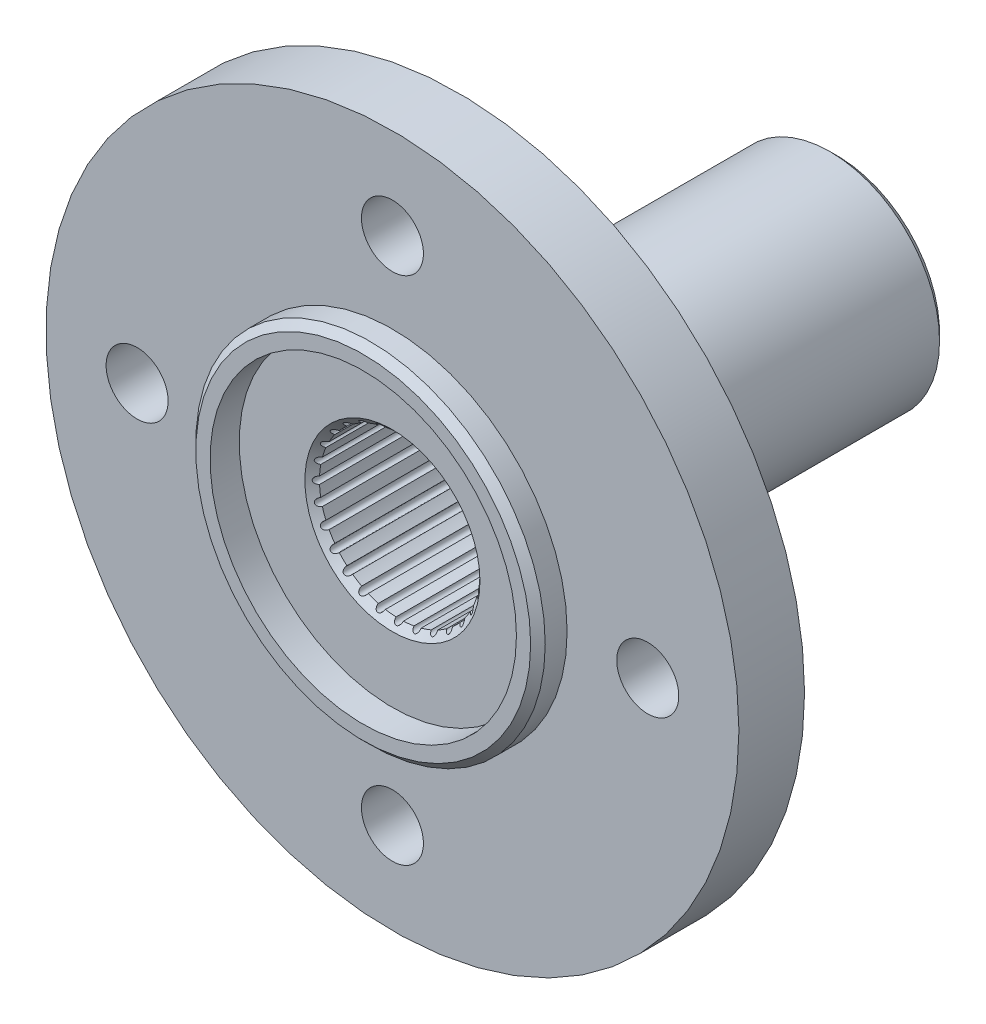
from build123d import *

# Parameters (mm, degrees)
SKETCH1_R           = 47.5
BOSS_EXTRUDE1_DEPTH = 9
SKETCH2_R           = 20
BOSS_EXTRUDE2_DEPTH = 22
SKETCH3_R           = 15
BOSS_EXTRUDE3_DEPTH = 30
SKETCH6_R           = 11
CUT_EXTRUDE2_DEPTH  = 25
CHAMFER2_SIZE       = 1
CUT_EXTRUDE5_REACH  = 92.739
SKETCH9_R           = 4.25
CHAMFER3_SIZE       = 1
SKETCH12_R          = 23.95
BOSS_EXTRUDE4_DEPTH = 4
SKETCH13_R          = 21
CUT_EXTRUDE6_DEPTH  = 4
CHAMFER4_SIZE       = 1
SKETCH8_R           = 0.5
CUT_EXTRUDE4_DEPTH  = 25
SKETCH14_R          = 11
CUT_EXTRUDE7_DEPTH  = 79.182478856
CHAMFER5_SIZE       = 1
SKETCH15_R          = 0.5
CUT_EXTRUDE8_DEPTH  = 94.474595479


with BuildPart() as part:
    # Sketch1 → Boss-Extrude1 (new body)
    with BuildSketch(Plane.XY):
        Circle(SKETCH1_R)
    extrude(amount=BOSS_EXTRUDE1_DEPTH)

    # Sketch2 → Boss-Extrude2 (add)
    with BuildSketch(Plane(origin=(0, 0, 0), x_dir=(-1, 0, 0), z_dir=(0, 0, -1))):
        Circle(SKETCH2_R)
    extrude(amount=BOSS_EXTRUDE2_DEPTH)

    # Sketch3 → Boss-Extrude3 (add)
    with BuildSketch(Plane(origin=(0, 0, -22), x_dir=(-1, 0, 0), z_dir=(0, 0, -1))):
        Circle(SKETCH3_R)
    extrude(amount=BOSS_EXTRUDE3_DEPTH)

    # Sketch6 → Cut-Extrude2 (cut)
    with BuildSketch(Plane(origin=(0, 0, -52), x_dir=(-1, 0, 0), z_dir=(0, 0, -1))):
        Circle(SKETCH6_R)
    extrude(amount=-CUT_EXTRUDE2_DEPTH, mode=Mode.SUBTRACT)

    # Chamfer2
    chamfer2_edges = [part.edges().sort_by_distance(p)[0] for p in [
        (11, 0, -52),
    ]]
    chamfer(chamfer2_edges, length=CHAMFER2_SIZE)

    # Sketch9 → Cut-Extrude5 (cut, up to next)
    with BuildSketch(Plane.XY.offset(9), mode=Mode.PRIVATE) as cut_extrude5_sk1:
        with Locations((0, 35)):
            Circle(SKETCH9_R)
    cut_extrude5_tool1 = extrude(cut_extrude5_sk1.sketch, amount=-CUT_EXTRUDE5_REACH, mode=Mode.PRIVATE) & part.part
    # Sketch9 → Cut-Extrude5 (cut, up to next)
    with BuildSketch(Plane.XY.offset(9), mode=Mode.PRIVATE) as cut_extrude5_sk2:
        with Locations((35, 0)):
            Circle(SKETCH9_R)
    cut_extrude5_tool2 = extrude(cut_extrude5_sk2.sketch, amount=-CUT_EXTRUDE5_REACH, mode=Mode.PRIVATE) & part.part
    # Sketch9 → Cut-Extrude5 (cut, up to next)
    with BuildSketch(Plane.XY.offset(9), mode=Mode.PRIVATE) as cut_extrude5_sk3:
        with Locations((0, -35)):
            Circle(SKETCH9_R)
    cut_extrude5_tool3 = extrude(cut_extrude5_sk3.sketch, amount=-CUT_EXTRUDE5_REACH, mode=Mode.PRIVATE) & part.part
    # Sketch9 → Cut-Extrude5 (cut, up to next)
    with BuildSketch(Plane.XY.offset(9), mode=Mode.PRIVATE) as cut_extrude5_sk4:
        with Locations((-35, 0)):
            Circle(SKETCH9_R)
    cut_extrude5_tool4 = extrude(cut_extrude5_sk4.sketch, amount=-CUT_EXTRUDE5_REACH, mode=Mode.PRIVATE) & part.part
    add(cut_extrude5_tool1.solids().sort_by_distance((0, 35, 9))[0], mode=Mode.SUBTRACT)
    add(cut_extrude5_tool2.solids().sort_by_distance((35, 0, 9))[0], mode=Mode.SUBTRACT)
    add(cut_extrude5_tool3.solids().sort_by_distance((0, -35, 9))[0], mode=Mode.SUBTRACT)
    add(cut_extrude5_tool4.solids().sort_by_distance((-35, 0, 9))[0], mode=Mode.SUBTRACT)

    # Chamfer3
    chamfer3_edges = [part.edges().sort_by_distance(p)[0] for p in [
        (15, 0, -52),
    ]]
    chamfer(chamfer3_edges, length=CHAMFER3_SIZE)

    # Sketch12 → Boss-Extrude4 (add)
    with BuildSketch(Plane.XY.offset(9)):
        Circle(SKETCH12_R)
    extrude(amount=BOSS_EXTRUDE4_DEPTH)

    # Sketch13 → Cut-Extrude6 (cut)
    with BuildSketch(Plane.XY.offset(13)):
        Circle(SKETCH13_R)
    extrude(amount=-CUT_EXTRUDE6_DEPTH, mode=Mode.SUBTRACT)

    # Chamfer4
    chamfer4_edges = [part.edges().sort_by_distance(p)[0] for p in [
        (-23.95, 0, 13),
    ]]
    chamfer(chamfer4_edges, length=CHAMFER4_SIZE)

    # Sketch8 → Cut-Extrude4 (cut)
    with BuildSketch(Plane(origin=(0, 0, -52), x_dir=(-1, 0, 0), z_dir=(0, 0, -1))):
        with Locations((0, 11)):
            Circle(SKETCH8_R)
        with Locations((2.447730274, 10.724207034)):
            Circle(SKETCH8_R)
        with Locations((4.77272113, 9.910657547)):
            Circle(SKETCH8_R)
        with Locations((6.85838782, 8.600146307)):
            Circle(SKETCH8_R)
        with Locations((8.600146307, 6.85838782)):
            Circle(SKETCH8_R)
        with Locations((9.910657547, 4.77272113)):
            Circle(SKETCH8_R)
        with Locations((10.724207034, 2.447730274)):
            Circle(SKETCH8_R)
        with Locations((11, 0)):
            Circle(SKETCH8_R)
        with Locations((10.724207034, -2.447730274)):
            Circle(SKETCH8_R)
        with Locations((9.910657547, -4.77272113)):
            Circle(SKETCH8_R)
        with Locations((8.600146307, -6.85838782)):
            Circle(SKETCH8_R)
        with Locations((6.85838782, -8.600146307)):
            Circle(SKETCH8_R)
        with Locations((4.77272113, -9.910657547)):
            Circle(SKETCH8_R)
        with Locations((2.447730274, -10.724207034)):
            Circle(SKETCH8_R)
        with Locations((0, -11)):
            Circle(SKETCH8_R)
        with Locations((-2.447730274, -10.724207034)):
            Circle(SKETCH8_R)
        with Locations((-4.77272113, -9.910657547)):
            Circle(SKETCH8_R)
        with Locations((-6.85838782, -8.600146307)):
            Circle(SKETCH8_R)
        with Locations((-8.600146307, -6.85838782)):
            Circle(SKETCH8_R)
        with Locations((-9.910657547, -4.77272113)):
            Circle(SKETCH8_R)
        with Locations((-10.724207034, -2.447730274)):
            Circle(SKETCH8_R)
        with Locations((-11, 0)):
            Circle(SKETCH8_R)
        with Locations((-10.724207034, 2.447730274)):
            Circle(SKETCH8_R)
        with Locations((-9.910657547, 4.77272113)):
            Circle(SKETCH8_R)
        with Locations((-8.600146307, 6.85838782)):
            Circle(SKETCH8_R)
        with Locations((-6.85838782, 8.600146307)):
            Circle(SKETCH8_R)
        with Locations((-4.77272113, 9.910657547)):
            Circle(SKETCH8_R)
        with Locations((-2.447730274, 10.724207034)):
            Circle(SKETCH8_R)
    extrude(amount=-CUT_EXTRUDE4_DEPTH, mode=Mode.SUBTRACT)

    # Sketch14 → Cut-Extrude7 (cut, through all)
    with BuildSketch(Plane(origin=(0, 0, -27), x_dir=(-1, 0, 0), z_dir=(0, 0, -1))):
        with Locations(Location((0, 0, 0), (0, 0, 357.39542213))):
            Circle(SKETCH14_R)
    extrude(amount=-CUT_EXTRUDE7_DEPTH, mode=Mode.SUBTRACT)

    # Chamfer5
    chamfer5_edges = [part.edges().sort_by_distance(p)[0] for p in [
        (10.988636364, 0.499870851, 9),
    ]]
    chamfer(chamfer5_edges, length=CHAMFER5_SIZE)

    # Sketch15 → Cut-Extrude8 (cut, through all)
    with BuildSketch(Plane(origin=(0, 0, -52), x_dir=(-1, 0, 0), z_dir=(0, 0, -1))):
        with Locations((8.600146307, 6.85838782)):
            Circle(SKETCH15_R)
        with Locations((6.85838782, 8.600146307)):
            Circle(SKETCH15_R)
        with Locations((4.77272113, 9.910657547)):
            Circle(SKETCH15_R)
        with Locations((2.447730274, 10.724207034)):
            Circle(SKETCH15_R)
        with Locations((0, 11)):
            Circle(SKETCH15_R)
        with Locations((4.77272113, -9.910657547)):
            Circle(SKETCH15_R)
        with Locations((6.85838782, -8.600146307)):
            Circle(SKETCH15_R)
        with Locations((8.600146307, -6.85838782)):
            Circle(SKETCH15_R)
        with Locations((9.910657547, -4.77272113)):
            Circle(SKETCH15_R)
        with Locations((10.724207034, -2.447730274)):
            Circle(SKETCH15_R)
        with Locations((11, 0)):
            Circle(SKETCH15_R)
        with Locations((10.724207034, 2.447730274)):
            Circle(SKETCH15_R)
        with Locations((9.910657547, 4.77272113)):
            Circle(SKETCH15_R)
        with Locations((-10.724207034, -2.447730274)):
            Circle(SKETCH15_R)
        with Locations((-9.910657547, -4.77272113)):
            Circle(SKETCH15_R)
        with Locations((-8.600146307, -6.85838782)):
            Circle(SKETCH15_R)
        with Locations((-6.85838782, -8.600146307)):
            Circle(SKETCH15_R)
        with Locations((-4.77272113, -9.910657547)):
            Circle(SKETCH15_R)
        with Locations((-2.447730274, -10.724207034)):
            Circle(SKETCH15_R)
        with Locations((0, -11)):
            Circle(SKETCH15_R)
        with Locations((2.447730274, -10.724207034)):
            Circle(SKETCH15_R)
        with Locations((-2.447730274, 10.724207034)):
            Circle(SKETCH15_R)
        with Locations((-4.77272113, 9.910657547)):
            Circle(SKETCH15_R)
        with Locations((-6.85838782, 8.600146307)):
            Circle(SKETCH15_R)
        with Locations((-8.600146307, 6.85838782)):
            Circle(SKETCH15_R)
        with Locations((-9.910657547, 4.77272113)):
            Circle(SKETCH15_R)
        with Locations((-10.724207034, 2.447730274)):
            Circle(SKETCH15_R)
        with Locations((-11, 0)):
            Circle(SKETCH15_R)
    extrude(amount=-CUT_EXTRUDE8_DEPTH, mode=Mode.SUBTRACT)

    # Sketch16 → Cut-Revolve1 (revolve, cut)
    with BuildSketch(Plane(origin=(0, 0, 0), x_dir=(1, 0, 0), z_dir=(0, 1, 0)), mode=Mode.PRIVATE) as cut_revolve1_sk:
        with BuildLine():
            ThreePointArc((-15, 22), (-16.26573764, 10.719485827), (-20, 0))
            Line((-20, 0), (-20, 22))
            Line((-20, 22), (-15, 22))
        make_face()
    revolve(cut_revolve1_sk.sketch.rotate(Axis((0, 0, 0), (0, 0, -1)), 180), axis=Axis((0, 0, 0), (0, 0, -1)), mode=Mode.SUBTRACT)


solid = part.part
